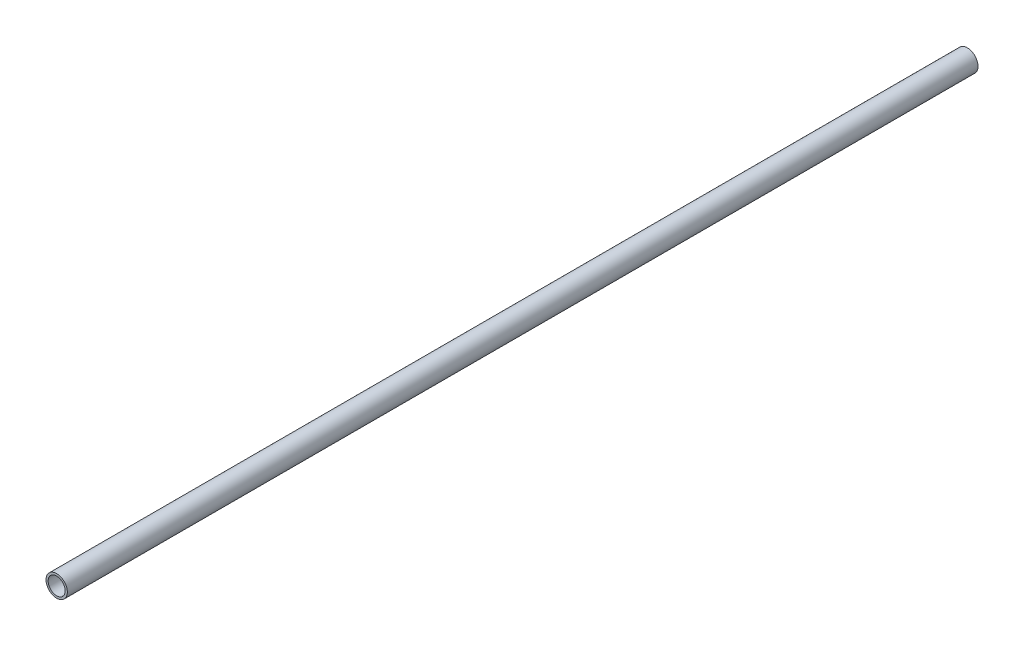
from build123d import *

# Parameters (mm, degrees)
SWEEP1_PROFILE_R     = 5
CUT_SWEEP1_PROFILE_R = 4


with BuildPart() as part:
    # Sweep1: sweep along a path in Sketch32
    with BuildLine(Plane(origin=(0, 0, 0), x_dir=(1, 0, 0), z_dir=(0, 1, 0))) as sweep1_path:
        Line((200.132445986, -213.37896957), (200.132445986, 213.37896957))
    # Sweep1 profile (on start of the path) → Sweep1 (sweep)
    with BuildSketch(Plane(origin=(200.132445986, 0, 213.37896957), x_dir=(-1, 0, 0), z_dir=(0, 0, -1))):
        Circle(SWEEP1_PROFILE_R)
    sweep(path=sweep1_path.line)

    # Cut-Sweep1: sweep along a path in Sketch32<2>
    with BuildLine(Plane(origin=(0, 0, 0), x_dir=(1, 0, 0), z_dir=(0, 1, 0))) as cut_sweep1_path:
        Line((200.132445986, -213.37896957), (200.132445986, 213.37896957))
    # Cut-Sweep1 profile (on start of the path) → Cut-Sweep1 (sweep, cut)
    with BuildSketch(Plane(origin=(200.132445986, 0, 213.37896957), x_dir=(-1, 0, 0), z_dir=(0, 0, -1))):
        Circle(CUT_SWEEP1_PROFILE_R)
    sweep(path=cut_sweep1_path.line, mode=Mode.SUBTRACT)


solid = part.part
